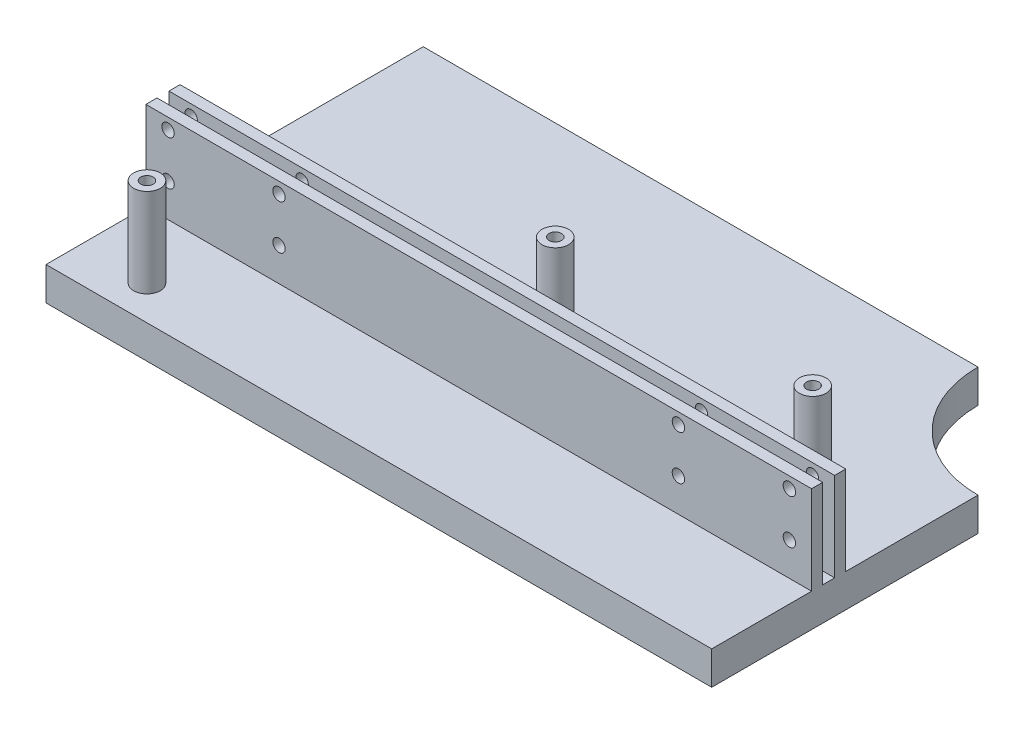
from build123d import *

# Parameters (mm, degrees)
BOSS_EXTRUDE1_DEPTH = 7.5
SKETCH2_W           = 150
SKETCH2_H           = 2.5
BOSS_EXTRUDE2_DEPTH = 20
SKETCH3_R           = 1.4
CUT_EXTRUDE1_DEPTH  = 10
SKETCH4_R           = 3
BOSS_EXTRUDE3_DEPTH = 20
SKETCH5_R           = 1.4
CUT_EXTRUDE2_DEPTH  = 8


with BuildPart() as part:
    # Sketch1 → Boss-Extrude1 (new body)
    with BuildSketch(Plane(origin=(0, 0, 0), x_dir=(1, 0, 0), z_dir=(0, 1, 0))):
        with BuildLine():
            Line((-150, 85), (-25, 85))
            ThreePointArc((-25, 85), (-17.67766953, 67.32233047), (0, 60))
            Line((0, 60), (0, 0))
            Line((0, 0), (-150, 0))
            Line((-150, 0), (-150, 85))
        make_face()
    extrude(amount=BOSS_EXTRUDE1_DEPTH)

    # Sketch2 → Boss-Extrude2 (add)
    with BuildSketch(Plane(origin=(0, 7.5, 0), x_dir=(1, 0, 0), z_dir=(0, 1, 0))):
        with Locations((-75, 23.75)):
            Rectangle(SKETCH2_W, SKETCH2_H)
        with Locations((-75, 28.95)):
            Rectangle(SKETCH2_W, SKETCH2_H)
    extrude(amount=BOSS_EXTRUDE2_DEPTH)

    # Sketch3 → Cut-Extrude1 (cut)
    with BuildSketch(Plane.XY.offset(-22.5)):
        with Locations((-30, 25)):
            Circle(SKETCH3_R)
        with Locations((-5, 25)):
            Circle(SKETCH3_R)
        with Locations((-30, 15)):
            Circle(SKETCH3_R)
        with Locations((-5, 15)):
            Circle(SKETCH3_R)
        with Locations((-145, 15)):
            Circle(SKETCH3_R)
        with Locations((-120, 15)):
            Circle(SKETCH3_R)
        with Locations((-145, 25)):
            Circle(SKETCH3_R)
        with Locations((-120, 25)):
            Circle(SKETCH3_R)
    extrude(amount=-CUT_EXTRUDE1_DEPTH, mode=Mode.SUBTRACT)

    # Sketch4 → Boss-Extrude3 (add)
    with BuildSketch(Plane(origin=(0, 7.5, 0), x_dir=(1, 0, 0), z_dir=(0, 1, 0))):
        with Locations(Location((-78, 42.75, 0), (0, 0, 270))):
            Circle(SKETCH4_R)
        with Locations(Location((-20, 42.75, 0), (0, 0, 270))):
            Circle(SKETCH4_R)
        with Locations(Location((-135, 7.75, 0), (0, 0, 270))):
            Circle(SKETCH4_R)
    extrude(amount=BOSS_EXTRUDE3_DEPTH)

    # Sketch5 → Cut-Extrude2 (cut)
    with BuildSketch(Plane(origin=(0, 27.5, 0), x_dir=(1, 0, 0), z_dir=(0, 1, 0))):
        with Locations(Location((-78, 42.75, 0), (0, 0, 270))):
            Circle(SKETCH5_R)
        with Locations(Location((-20, 42.75, 0), (0, 0, 270))):
            Circle(SKETCH5_R)
        with Locations(Location((-135, 7.75, 0), (0, 0, 270))):
            Circle(SKETCH5_R)
    extrude(amount=-CUT_EXTRUDE2_DEPTH, mode=Mode.SUBTRACT)


solid = part.part
